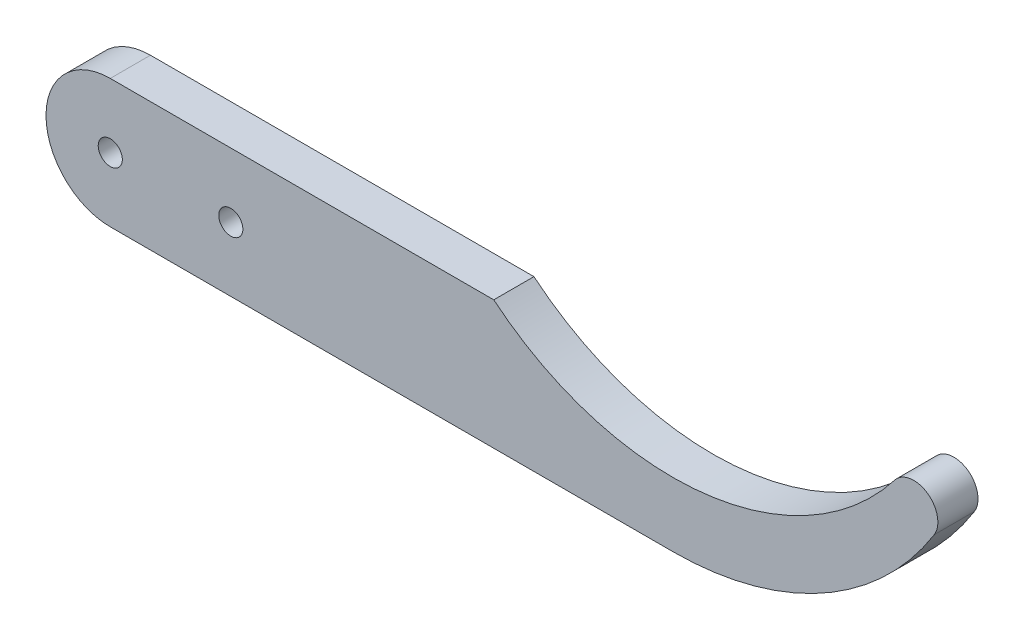
from build123d import *

# Parameters (mm, degrees)
ESQUISSE1_R        = 1.5
BOSS_EXTRU_1_DEPTH = 5


with BuildPart() as part:
    # Esquisse1 → Boss.-Extru.1 (new body)
    with BuildSketch(Plane.XY):
        with BuildLine():
            Line((0, 8), (20, 8))
            Line((20, 8), (32.728942549, 8))
            ThreePointArc((32.728942549, 8), (58.84637819, 0.211993808), (82.631578947, 13.517545651))
            ThreePointArc((82.631578947, 13.517545651), (86.714862069, 14.137746418), (87.547938522, 10.092522856))
            ThreePointArc((87.547938522, 10.092522856), (73.619262105, -3.172854276), (55, -8))
            Line((55, -8), (0, -8))
            Line((0, -8), (-15, -8))
            ThreePointArc((-15, -8), (-23, 0), (-15, 8))
            Line((-15, 8), (0, 8))
        make_face()
        Circle(ESQUISSE1_R, mode=Mode.SUBTRACT)
        with Locations((-15, 0)):
            Circle(ESQUISSE1_R, mode=Mode.SUBTRACT)
    extrude(amount=BOSS_EXTRU_1_DEPTH)


solid = part.part
